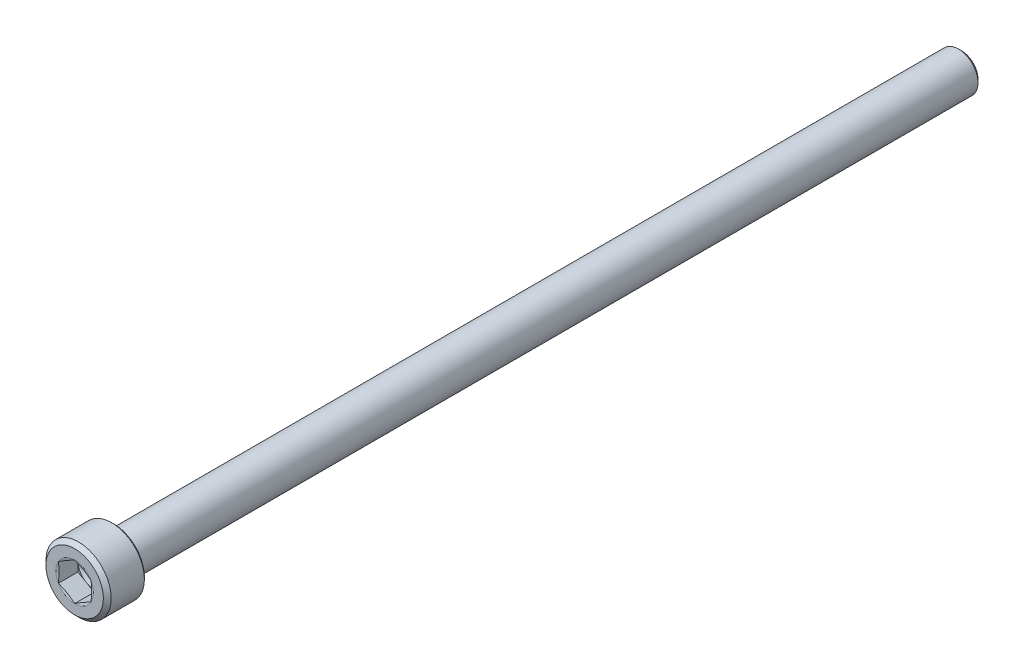
from build123d import *

# Parameters (mm, degrees)
CUT_EXTRUDE1_DEPTH = 3


with BuildPart() as part:
    # Sketch1 → Revolve1 (revolve)
    with BuildSketch(Plane(origin=(0, 0, 0), x_dir=(0, 0, -1), z_dir=(1, 0, 0)), mode=Mode.PRIVATE) as revolve1_sk:
        with BuildLine():
            Line((0, 0), (0, 4.4))
            Line((0, 4.4), (0.6, 5))
            Line((0.6, 5), (5.69, 5))
            Line((5.69, 5), (6, 4.69))
            Line((6, 4.69), (6, 3.4))
            ThreePointArc((6, 3.4), (6.046179295, 3.255234258), (6.167656961, 3.163949955))
            Line((6.167656961, 3.163949955), (6.597656961, 3.013949955))
            ThreePointArc((6.597656961, 3.013949955), (6.638241835, 3.003512159), (6.68, 3))
            Line((6.68, 3), (135.5, 3))
            Line((135.5, 3), (136, 2.5))
            Line((136, 2.5), (136, 0))
            Line((136, 0), (0, 0))
        make_face()
    revolve(revolve1_sk.sketch.rotate(Axis((0, 0, 0), (0, 0, -1)), 90), axis=Axis((0, 0, 0), (0, 0, -1)))

    # Sketch2 → Cut-Extrude1 (cut)
    with BuildSketch(Plane.XY):
        Polygon((0, 2.886751346), (-2.5, 1.443375673), (-2.5, -1.443375673), (0, -2.886751346), (2.5, -1.443375673), (2.5, 1.443375673), align=None)
    extrude(amount=-CUT_EXTRUDE1_DEPTH, mode=Mode.SUBTRACT)

    # Sketch3 → Cut-Revolve2 (revolve, cut)
    with BuildSketch(Plane(origin=(0, 0, 0), x_dir=(0, 0, -1), z_dir=(1, 0, 0)), mode=Mode.PRIVATE) as cut_revolve2_sk:
        Polygon((3, 0), (3, 2.5), (4.443375673, 0), align=None)
    revolve(cut_revolve2_sk.sketch.rotate(Axis((0, 0, -3), (0, 0, -1)), 90), axis=Axis((0, 0, -3), (0, 0, -1)), mode=Mode.SUBTRACT)

    # Sketch4 → Cut-Revolve3 (revolve, cut)
    with BuildSketch(Plane(origin=(0, 0, 0), x_dir=(0, 0, -1), z_dir=(1, 0, 0))):
        Polygon((0, 2.886751346), (0, 2.5), (0.103629711, 2.5), align=None)
    revolve(axis=Axis((0, 0, 0), (0, 0, -1)), mode=Mode.SUBTRACT)


solid = part.part
